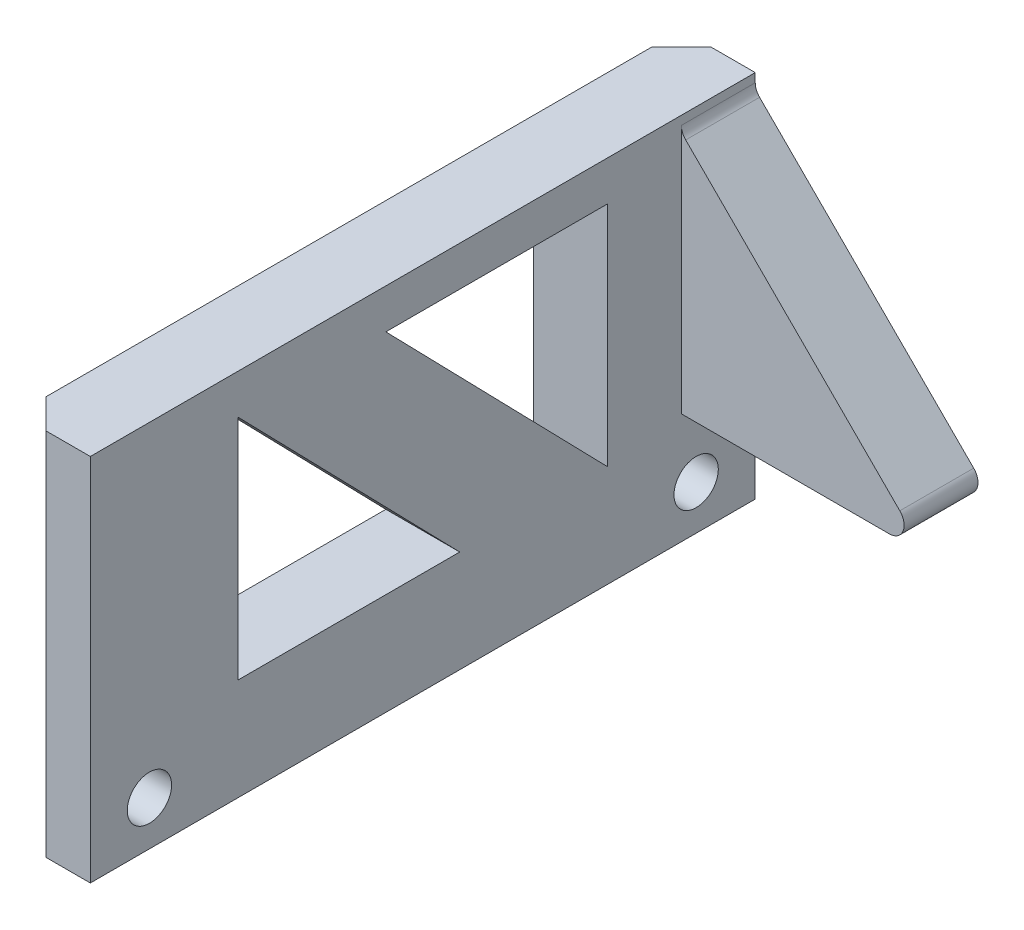
from build123d import *

# Parameters (mm, degrees)
SKETCH1_W           = 45
SKETCH1_H           = 25
BOSS_EXTRUDE1_DEPTH = 5
SKETCH2_R           = 1.5
CUT_EXTRUDE1_DEPTH  = 27.220221204
CUT_EXTRUDE2_DEPTH  = 27.220221204
CHAMFER2_SIZE       = 2
BOSS_EXTRUDE2_DEPTH = 5
FILLET1_R           = 1


with BuildPart() as part:
    # Sketch1 → Boss-Extrude1 (new body)
    with BuildSketch(Plane(origin=(0, 0, 0), x_dir=(0, 0, -1), z_dir=(1, 0, 0))):
        Rectangle(SKETCH1_W, SKETCH1_H)
    extrude(amount=BOSS_EXTRUDE1_DEPTH)

    # Sketch2 → Cut-Extrude1 (cut, through all)
    with BuildSketch(Plane(origin=(5, 0, 0), x_dir=(0, 0, -1), z_dir=(1, 0, 0))):
        with Locations((-18.5, -9.5)):
            Circle(SKETCH2_R)
        with Locations((18.5, -9.5)):
            Circle(SKETCH2_R)
    extrude(amount=-CUT_EXTRUDE1_DEPTH, mode=Mode.SUBTRACT)

    # Sketch3 → Cut-Extrude2 (cut, through all)
    with BuildSketch(Plane(origin=(5, 0, 0), x_dir=(0, 0, -1), z_dir=(1, 0, 0))):
        Polygon((-12.5, 9.80361421), (-12.5, -5.599476508), (2.5, -5.599476508), align=None)
        Polygon((-2.5, 9.80361421), (12.5, 9.80361421), (12.5, -5.599476508), align=None)
    extrude(amount=-CUT_EXTRUDE2_DEPTH, mode=Mode.SUBTRACT)

    # Chamfer2
    chamfer2_edges = [part.edges().sort_by_distance(p)[0] for p in [
        (0, 0, 22.5),
        (0, 0, -22.5),
    ]]
    chamfer(chamfer2_edges, length=CHAMFER2_SIZE)

    # Sketch4 → Boss-Extrude2 (add)
    with BuildSketch(Plane(origin=(0, 0, -22.5), x_dir=(-1, 0, 0), z_dir=(0, 0, -1))):
        Polygon((-5, -5), (-21.490292585, -5), (-5, 11.490292585), align=None)
    extrude(amount=-BOSS_EXTRUDE2_DEPTH)

    # Fillet1
    fillet1_edges = [part.edges().sort_by_distance(p)[0] for p in [
        (5, 11.490292585, -20),
        (21.490292585, -5, -20),
    ]]
    fillet(fillet1_edges, radius=FILLET1_R)


solid = part.part
